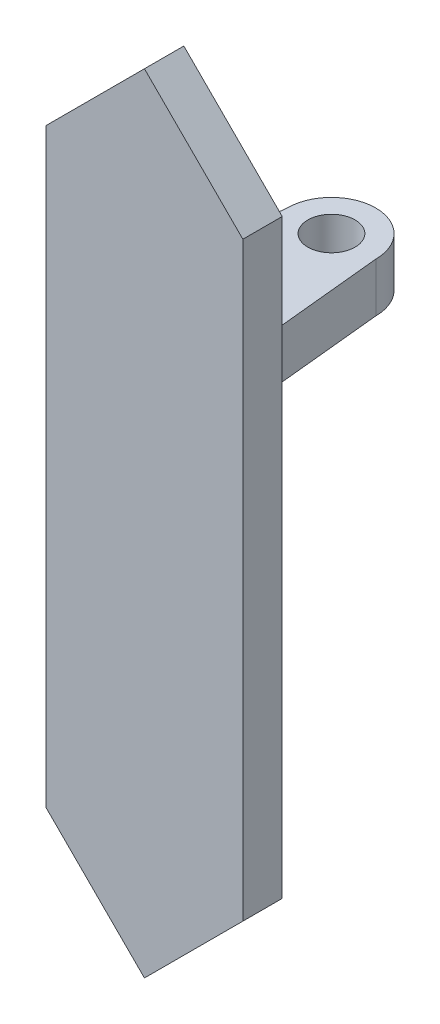
from build123d import *

# Parameters (mm, degrees)
EXTRUDE_1_DEPTH     = 4
SKETCH_2_W          = 12
SKETCH_2_H          = 5
EXTRUDE_2_DEPTH     = 20
SKETCH_6_R          = 2.4
CUT_EXTRUDE_5_DEPTH = 21


with BuildPart() as part:
    # 草图1 → 凸台-拉伸1 (new body)
    with BuildSketch(Plane.XY):
        Polygon((0.147281285, 10), (0.147281285, 70), (10.147281285, 80), (20.147281285, 70), (20.147281285, 10), (10.147281285, 0), align=None)
    extrude(amount=EXTRUDE_1_DEPTH)

    # 草图2 → 凸台-拉伸2 (add)
    with BuildSketch(Plane(origin=(0, 0, 0), x_dir=(-1, 0, 0), z_dir=(0, 0, -1))):
        with Locations((-10.147281285, 53.5)):
            Rectangle(SKETCH_2_W, SKETCH_2_H)
    extrude(amount=EXTRUDE_2_DEPTH)

    # 草图6 → 切除-拉伸5 (cut)
    with BuildSketch(Plane.XZ.offset(-51)):
        with Locations(Location((10.147281285, -15, 0), (0, 0, 270))):
            Circle(SKETCH_6_R)
        with BuildLine():
            ThreePointArc((14.647281285, -15), (10.147281285, -19.5), (5.647281285, -15))
            Line((5.647281285, -15), (4.147281285, 0))
            Line((4.147281285, 0), (4.147281285, -20))
            Line((4.147281285, -20), (16.147281285, -20))
            Line((16.147281285, -20), (16.147281285, 0))
            Line((16.147281285, 0), (14.647281285, -15))
        make_face()
    extrude(amount=-CUT_EXTRUDE_5_DEPTH, mode=Mode.SUBTRACT)


solid = part.part
